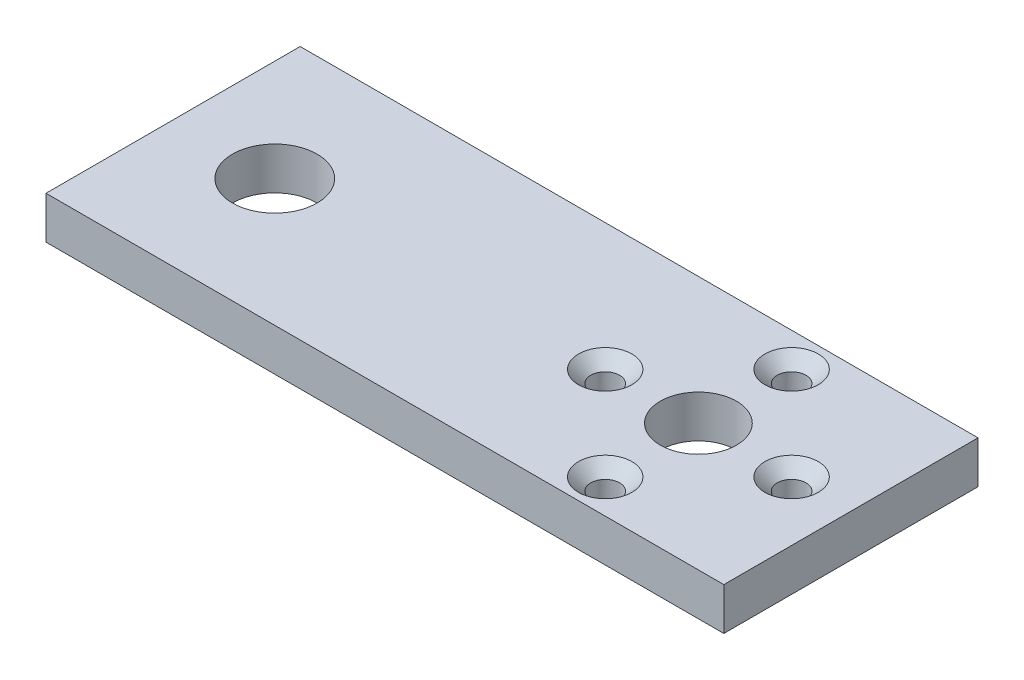
from build123d import *

# Parameters (mm, degrees)
SKETCH1_W                                           = 80
SKETCH1_H                                           = 30
SKETCH1_R                                           = 4.5
SKETCH1_R_2                                         = 5
BOSS_EXTRUDE1_DEPTH                                 = 5
CSK_FOR_M3_COUNTERSUNK_FLAT_HEAD_SCREW1_D           = 3.4
CSK_FOR_M3_COUNTERSUNK_FLAT_HEAD_SCREW1_CSINK_D     = 6.3
CSK_FOR_M3_COUNTERSUNK_FLAT_HEAD_SCREW1_CSINK_ANGLE = 90
CIRPATTERN1_COUNT                                   = 4


with BuildPart() as part:
    # Sketch1 → Boss-Extrude1 (new body)
    with BuildSketch(Plane(origin=(0, 0, 0), x_dir=(1, 0, 0), z_dir=(0, 1, 0))):
        Rectangle(SKETCH1_W, SKETCH1_H)
        with Locations(Location((22, 0, 0), (0, 0, 270))):
            Circle(SKETCH1_R, mode=Mode.SUBTRACT)
        with Locations(Location((-28, 0, 0), (0, 0, 270))):
            Circle(SKETCH1_R_2, mode=Mode.SUBTRACT)
    extrude(amount=BOSS_EXTRUDE1_DEPTH)

    # CSK for M3 Countersunk Flat Head Screw1 (through all)
    with Locations(Plane(origin=(0, 5, 0), x_dir=(1, 0, 0), z_dir=(0, 1, 0))):
        with Locations((11, 0)):
            csk_for_m3_countersunk_flat_head_screw1 = CounterSinkHole(CSK_FOR_M3_COUNTERSUNK_FLAT_HEAD_SCREW1_D / 2, CSK_FOR_M3_COUNTERSUNK_FLAT_HEAD_SCREW1_CSINK_D / 2, counter_sink_angle=CSK_FOR_M3_COUNTERSUNK_FLAT_HEAD_SCREW1_CSINK_ANGLE)

    # CirPattern1: CSK for M3 Countersunk Flat Head Screw1 ×4 about axis
    cirpattern1_axis = Axis((22, 0, 0), (0, 1, 0))
    for i in range(1, CIRPATTERN1_COUNT):
        add(csk_for_m3_countersunk_flat_head_screw1.rotate(cirpattern1_axis, i * 360 / CIRPATTERN1_COUNT), mode=Mode.SUBTRACT)


solid = part.part
